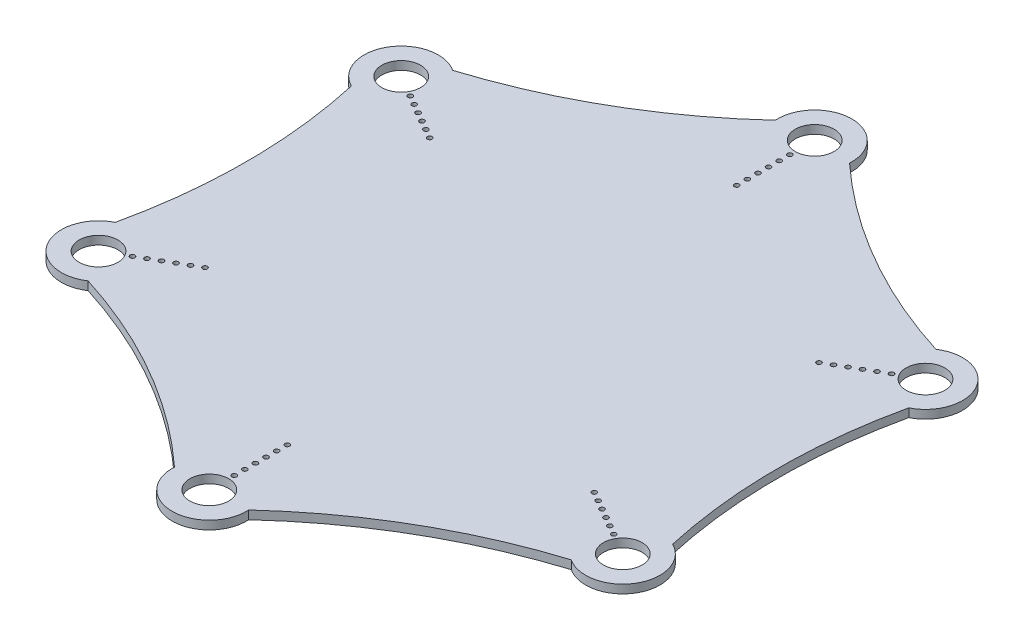
from build123d import *

# Parameters (mm, degrees)
ESBO_O1_R                = 3.65
RESSALTO_EXTRUS_O1_DEPTH = 1.6
ESBO_O3_R                = 0.0001
RESSALTO_EXTRUS_O3_DEPTH = 0.001
ESBO_O5_R                = 0.45
CORTE_EXTRUS_O2_DEPTH    = 1.6


with BuildPart() as part:
    # Esboço1 → Ressalto-extrusão1 (new body)
    with BuildSketch(Plane(origin=(0, 0, 0), x_dir=(1, 0, 0), z_dir=(0, 1, 0))):
        with BuildLine():
            ThreePointArc((-52.484604611, -22.234349076), (-50.025216279, 0), (-52.484604611, 22.234349076))
            ThreePointArc((-52.484604611, 22.234349076), (-55.425625842, 32), (-45.497813442, 34.335826363))
            ThreePointArc((-45.497813442, 34.335826363), (-25.01260814, 43.323108128), (-6.98679117, 56.570175439))
            ThreePointArc((-6.98679117, 56.570175439), (0, 64), (6.98679117, 56.570175439))
            ThreePointArc((6.98679117, 56.570175439), (25.01260814, 43.323108128), (45.497813442, 34.335826363))
            ThreePointArc((45.497813442, 34.335826363), (55.425625842, 32), (52.484604611, 22.234349076))
            ThreePointArc((52.484604611, 22.234349076), (50.025216279, 0), (52.484604611, -22.234349076))
            ThreePointArc((52.484604611, -22.234349076), (55.425625842, -32), (45.497813442, -34.335826363))
            ThreePointArc((45.497813442, -34.335826363), (25.01260814, -43.323108128), (6.98679117, -56.570175439))
            ThreePointArc((6.98679117, -56.570175439), (0, -64), (-6.98679117, -56.570175439))
            ThreePointArc((-6.98679117, -56.570175439), (-25.01260814, -43.323108128), (-45.497813442, -34.335826363))
            ThreePointArc((-45.497813442, -34.335826363), (-55.425625842, -32), (-52.484604611, -22.234349076))
        make_face()
        with Locations(Location((-49.363448016, 28.5, 0), (0, 0, 270))):
            Circle(ESBO_O1_R, mode=Mode.SUBTRACT)
        with Locations(Location((-49.363448016, -28.5, 0), (0, 0, 270))):
            Circle(ESBO_O1_R, mode=Mode.SUBTRACT)
        with Locations(Location((0, -57, 0), (0, 0, 270))):
            Circle(ESBO_O1_R, mode=Mode.SUBTRACT)
        with Locations(Location((49.363448016, -28.5, 0), (0, 0, 270))):
            Circle(ESBO_O1_R, mode=Mode.SUBTRACT)
        with Locations(Location((49.363448016, 28.5, 0), (0, 0, 270))):
            Circle(ESBO_O1_R, mode=Mode.SUBTRACT)
        with Locations(Location((0, 57, 0), (0, 0, 270))):
            Circle(ESBO_O1_R, mode=Mode.SUBTRACT)
    extrude(amount=RESSALTO_EXTRUS_O1_DEPTH)

    # Esboço3 → Ressalto-extrusão3 (add)
    with BuildSketch(Plane(origin=(0, 1.6, 0), x_dir=(1, 0, 0), z_dir=(0, 1, 0))):
        with Locations(Location((0, 0, 0), (0, 0, 270))):
            Circle(ESBO_O3_R)
    extrude(amount=RESSALTO_EXTRUS_O3_DEPTH)

    # Esboço5 → Corte-extrusão2 (cut)
    with BuildSketch(Plane(origin=(0, 1.6, 0), x_dir=(1, 0, 0), z_dir=(0, 1, 0))):
        with Locations(Location((0, -52.32, 0), (0, 0, 270))):
            Circle(ESBO_O5_R)
        with Locations(Location((-45.310449126, -26.16, 0), (0, 0, 270))):
            Circle(ESBO_O5_R)
        with Locations(Location((-45.310449126, 26.16, 0), (0, 0, 270))):
            Circle(ESBO_O5_R)
        with Locations(Location((0, 52.32, 0), (0, 0, 270))):
            Circle(ESBO_O5_R)
        with Locations(Location((45.310449126, 26.16, 0), (0, 0, 270))):
            Circle(ESBO_O5_R)
        with Locations(Location((45.310449126, -26.16, 0), (0, 0, 270))):
            Circle(ESBO_O5_R)
        with Locations(Location((0, -50.32, 0), (0, 0, 270))):
            Circle(ESBO_O5_R)
        with Locations(Location((0, -48.32, 0), (0, 0, 270))):
            Circle(ESBO_O5_R)
        with Locations(Location((0, -46.32, 0), (0, 0, 270))):
            Circle(ESBO_O5_R)
        with Locations(Location((0, -44.32, 0), (0, 0, 270))):
            Circle(ESBO_O5_R)
        with Locations(Location((0, -42.32, 0), (0, 0, 270))):
            Circle(ESBO_O5_R)
        with Locations(Location((-36.650195088, -21.16, 0), (0, 0, 270))):
            Circle(ESBO_O5_R)
        with Locations(Location((-38.382245896, -22.16, 0), (0, 0, 270))):
            Circle(ESBO_O5_R)
        with Locations(Location((-40.114296703, -23.16, 0), (0, 0, 270))):
            Circle(ESBO_O5_R)
        with Locations(Location((-41.846347511, -24.16, 0), (0, 0, 270))):
            Circle(ESBO_O5_R)
        with Locations(Location((-43.578398318, -25.16, 0), (0, 0, 270))):
            Circle(ESBO_O5_R)
        with Locations(Location((-36.650195088, 21.16, 0), (0, 0, 270))):
            Circle(ESBO_O5_R)
        with Locations(Location((-38.382245896, 22.16, 0), (0, 0, 270))):
            Circle(ESBO_O5_R)
        with Locations(Location((-40.114296703, 23.16, 0), (0, 0, 270))):
            Circle(ESBO_O5_R)
        with Locations(Location((-41.846347511, 24.16, 0), (0, 0, 270))):
            Circle(ESBO_O5_R)
        with Locations(Location((-43.578398318, 25.16, 0), (0, 0, 270))):
            Circle(ESBO_O5_R)
        with Locations(Location((0, 42.32, 0), (0, 0, 270))):
            Circle(ESBO_O5_R)
        with Locations(Location((0, 44.32, 0), (0, 0, 270))):
            Circle(ESBO_O5_R)
        with Locations(Location((0, 46.32, 0), (0, 0, 270))):
            Circle(ESBO_O5_R)
        with Locations(Location((0, 48.32, 0), (0, 0, 270))):
            Circle(ESBO_O5_R)
        with Locations(Location((0, 50.32, 0), (0, 0, 270))):
            Circle(ESBO_O5_R)
        with Locations(Location((36.650195088, 21.16, 0), (0, 0, 270))):
            Circle(ESBO_O5_R)
        with Locations(Location((38.382245896, 22.16, 0), (0, 0, 270))):
            Circle(ESBO_O5_R)
        with Locations(Location((40.114296703, 23.16, 0), (0, 0, 270))):
            Circle(ESBO_O5_R)
        with Locations(Location((41.846347511, 24.16, 0), (0, 0, 270))):
            Circle(ESBO_O5_R)
        with Locations(Location((43.578398318, 25.16, 0), (0, 0, 270))):
            Circle(ESBO_O5_R)
        with Locations(Location((36.650195088, -21.16, 0), (0, 0, 270))):
            Circle(ESBO_O5_R)
        with Locations(Location((38.382245896, -22.16, 0), (0, 0, 270))):
            Circle(ESBO_O5_R)
        with Locations(Location((40.114296703, -23.16, 0), (0, 0, 270))):
            Circle(ESBO_O5_R)
        with Locations(Location((41.846347511, -24.16, 0), (0, 0, 270))):
            Circle(ESBO_O5_R)
        with Locations(Location((43.578398318, -25.16, 0), (0, 0, 270))):
            Circle(ESBO_O5_R)
    extrude(amount=-CORTE_EXTRUS_O2_DEPTH, mode=Mode.SUBTRACT)


solid = part.part
